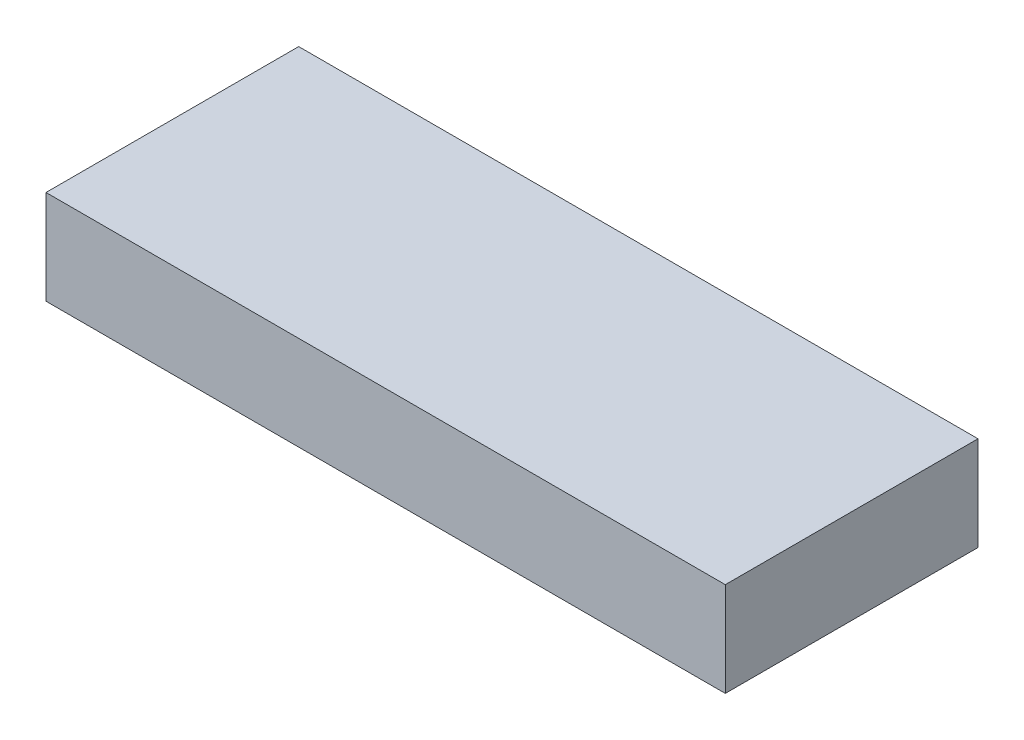
from build123d import *

# Parameters (mm, degrees)
SKETCH1_W           = 38.1
SKETCH1_H           = 14.1732
BOSS_EXTRUDE1_DEPTH = 5.2832


with BuildPart() as part:
    # Sketch1 → Boss-Extrude1 (new body)
    with BuildSketch(Plane(origin=(0, 0, 0), x_dir=(1, 0, 0), z_dir=(0, 1, 0))):
        with Locations((19.05, 7.0866)):
            Rectangle(SKETCH1_W, SKETCH1_H)
    extrude(amount=BOSS_EXTRUDE1_DEPTH)


solid = part.part
